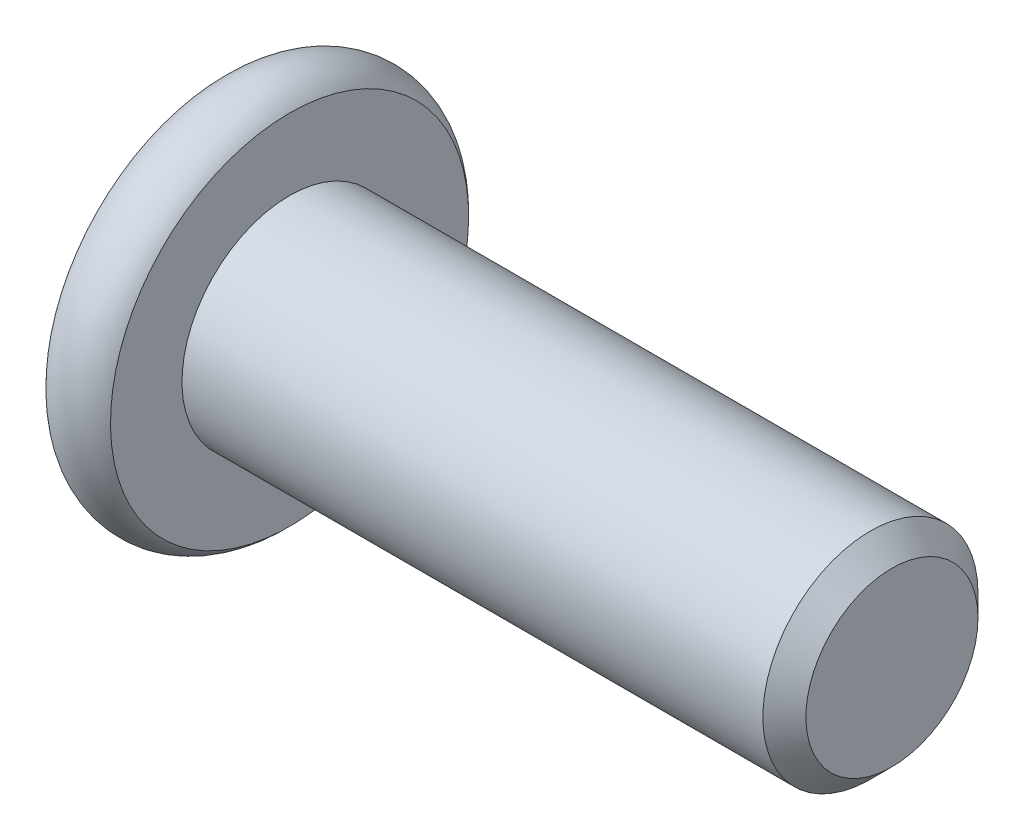
from build123d import *

# Parameters (mm, degrees)
SKETCH2_R           = 2.5
BOSS_EXTRUDE1_DEPTH = 14
CHAMFER1_SIZE       = 0.5
CUT_EXTRUDE1_DEPTH  = 2.3
SKETCH8_R           = 1.782050808
CUT_EXTRUDE2_DEPTH  = 1
CUT_EXTRUDE2_DRAFT  = -45


with BuildPart() as part:
    # Sketch2 → Boss-Extrude1 (new body)
    with BuildSketch(Plane(origin=(0, 0, 0), x_dir=(0, 0, -1), z_dir=(1, 0, 0))):
        Circle(SKETCH2_R)
    extrude(amount=-BOSS_EXTRUDE1_DEPTH)

    # Chamfer1
    chamfer1_edges = [part.edges().sort_by_distance(p)[0] for p in [
        (0, 0, 2.5),
    ]]
    chamfer(chamfer1_edges, length=CHAMFER1_SIZE)

    # Sketch6 → Revolve1 (revolve)
    with BuildSketch(Plane.XY):
        with BuildLine():
            Line((-15.5, 0), (-15.5, 4.161437828))
            ThreePointArc((-15.5, 4.161437828), (-14.75, 4.5), (-14, 4.161437828))
            Line((-14, 4.161437828), (-14, 0))
            Line((-14, 0), (-15.5, 0))
        make_face()
    revolve(axis=Axis((-14, 0, 0), (-1, 0, 0)))

    # Sketch7 → Cut-Extrude1 (cut)
    with BuildSketch(Plane.ZY.offset(15.5)):
        Polygon((0, 1.732050808), (-1.5, 0.866025404), (-1.5, -0.866025404), (0, -1.732050808), (1.5, -0.866025404), (1.5, 0.866025404), align=None)
    extrude(amount=-CUT_EXTRUDE1_DEPTH, mode=Mode.SUBTRACT)


with BuildPart() as cut_extrude2_tool:
    # Sketch8 → Cut-Extrude2 (with draft: the straight prism first)
    with BuildSketch(Plane.ZY.offset(15.5)):
        Circle(SKETCH8_R)
    extrude(amount=-CUT_EXTRUDE2_DEPTH)
    # Cut-Extrude2: the draft: its side faces are tilted about the plane it starts from
    cut_extrude2_sides = [cut_extrude2_tool.faces().sort_by_distance(p)[0] for p in [
        (-15, 0, -1.782050808),
    ]]
    draft(cut_extrude2_sides, Plane.ZY.offset(15.5), CUT_EXTRUDE2_DRAFT)


with BuildPart() as part_1:
    add(part.part)

    # Cut-Extrude2: cut by cut_extrude2_tool
    add(cut_extrude2_tool.part, mode=Mode.SUBTRACT)


solid = part_1.part
